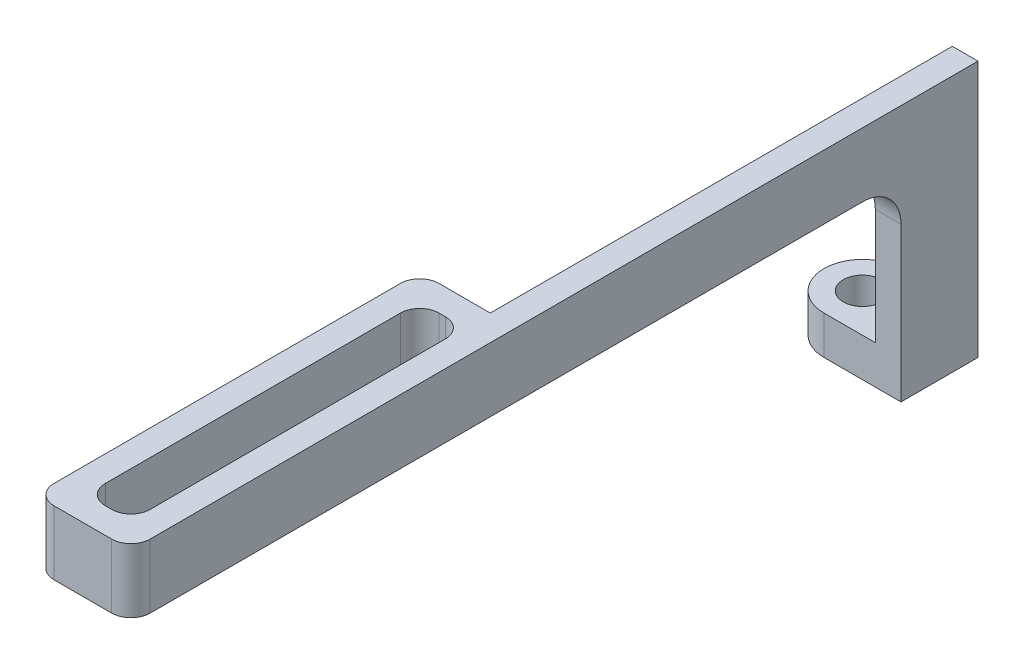
from build123d import *

# Parameters (mm, degrees)
SKETCH_1_R      = 3
SKETCH_1_R_2    = 1.5
EXTRUDE_1_DEPTH = 3
SKETCH_2_W      = 2
SKETCH_2_H      = 6
EXTRUDE_2_DEPTH = 15
SKETCH_3_W      = 3.5
SKETCH_3_H      = 26
EXTRUDE_3_DEPTH = 5
FILLET_1_R      = 3
FILLET_2_R      = 1.5


with BuildPart() as part:
    # 草图1 → 凸台-拉伸1 (new body)
    # profile 1 of 2: a face of its own
    with BuildSketch(Plane(origin=(0, 0, 0), x_dir=(1, 0, 0), z_dir=(0, 1, 0))):
        with BuildLine():
            Line((6, 3), (0, 3))
            ThreePointArc((0, 3), (2.121320344, 2.121320344), (3, 0))
            ThreePointArc((3, 0), (2.121320344, -2.121320344), (0, -3))
            Line((0, -3), (6, -3))
            Line((6, -3), (6, 3))
        make_face()
    # profile 2 of 2: a face of its own
    with BuildSketch(Plane(origin=(0, 0, 0), x_dir=(1, 0, 0), z_dir=(0, 1, 0))):
        Circle(SKETCH_1_R)
        with Locations(Location((0, 0, 0), (0, 0, 270))):
            Circle(SKETCH_1_R_2, mode=Mode.SUBTRACT)
    extrude(amount=EXTRUDE_1_DEPTH)

    # 草图2 → 凸台-拉伸2 (add)
    with BuildSketch(Plane(origin=(0, 0, 0), x_dir=(1, 0, 0), z_dir=(0, 1, 0))):
        with Locations((5, 0)):
            Rectangle(SKETCH_2_W, SKETCH_2_H)
    extrude(amount=EXTRUDE_2_DEPTH)

    # 草图3 → 凸台-拉伸3 (add)
    with BuildSketch(Plane(origin=(0, 15, 0), x_dir=(1, 0, 0), z_dir=(0, 1, 0))):
        Polygon((6, 3), (6, -63), (4, -63), (0.094051249, -63), (-1.5, -63), (-1.5, -33), (4, -33), (4, 3), align=None)
        with Locations((2.25, -48)):
            Rectangle(SKETCH_3_W, SKETCH_3_H, mode=Mode.SUBTRACT)
    extrude(amount=EXTRUDE_3_DEPTH)

    # 圆角1
    fillet_1_edges = [part.edges().sort_by_distance(p)[0] for p in [
        (5, 15, 3),
    ]]
    fillet(fillet_1_edges, radius=FILLET_1_R)

    # 圆角2
    fillet_2_edges = [part.edges().sort_by_distance(p)[0] for p in [
        (-1.5, 17.5, 33),
        (-1.5, 17.5, 63),
        (6, 17.5, 63),
        (4, 17.5, 35),
        (0.5, 17.5, 35),
        (0.5, 17.5, 61),
        (4, 17.5, 61),
    ]]
    fillet(fillet_2_edges, radius=FILLET_2_R)


solid = part.part
